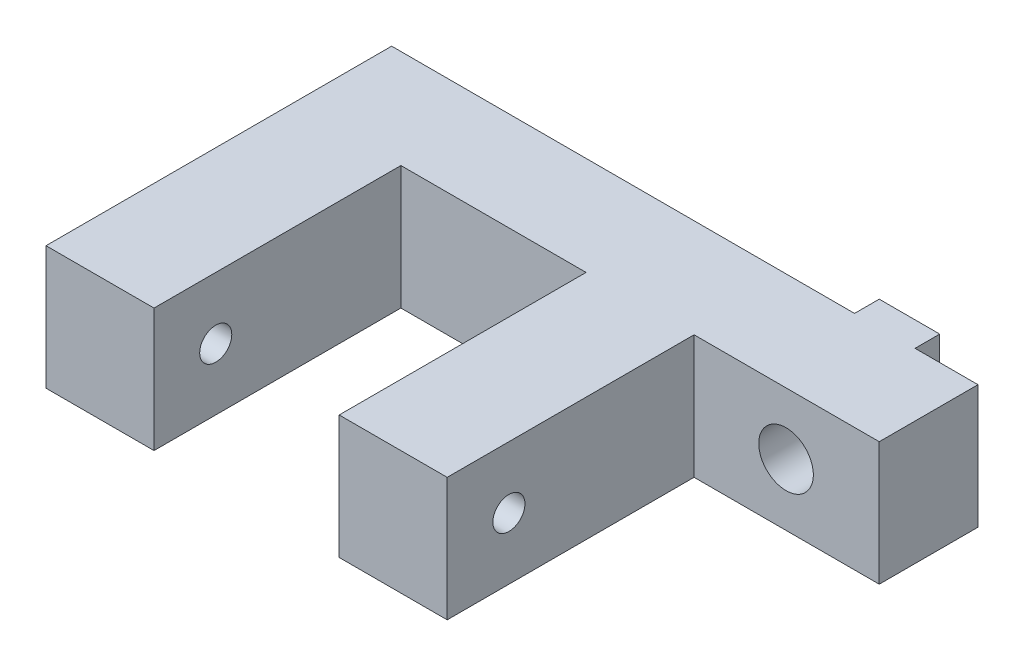
from build123d import *

# Parameters (mm, degrees)
EXTRUDE1_DEPTH         = 6.35
M4X0_7_TAPPED_HOLE1_D  = 3.3
F_10_CLEARANCE_HOLE1_D = 5.6134


with BuildPart() as part:
    # Sketch1 → Extrude1 (new, symmetric)
    with BuildSketch(Plane(origin=(0, 0, 0), x_dir=(1, 0, 0), z_dir=(0, 1, 0))):
        Polygon((47.625, 0), (53.848, 0), (53.848, -2.54), (60.325, -2.54), (60.325, -12.7), (41.275, -12.7), (41.275, -38.1), (30.1625, -38.1), (30.1625, -12.7), (11.1125, -12.7), (11.1125, -38.1), (0, -38.1), (0, -2.54), (47.625, -2.54), align=None)
    extrude(amount=EXTRUDE1_DEPTH, both=True)

    # M4x0.7 Tapped Hole1 (through all)
    with Locations(Plane(origin=(41.275, 0, 0), x_dir=(0, 0, -1), z_dir=(1, 0, 0))):
        with Locations((-31.75, 0)):
            Hole(M4X0_7_TAPPED_HOLE1_D / 2)

    # #10 Clearance Hole1 (through all)
    with Locations(Plane(origin=(0, 0, 0), x_dir=(-1, 0, 0), z_dir=(0, 0, -1))):
        with Locations((-50.7365, 0)):
            Hole(F_10_CLEARANCE_HOLE1_D / 2)


solid = part.part
